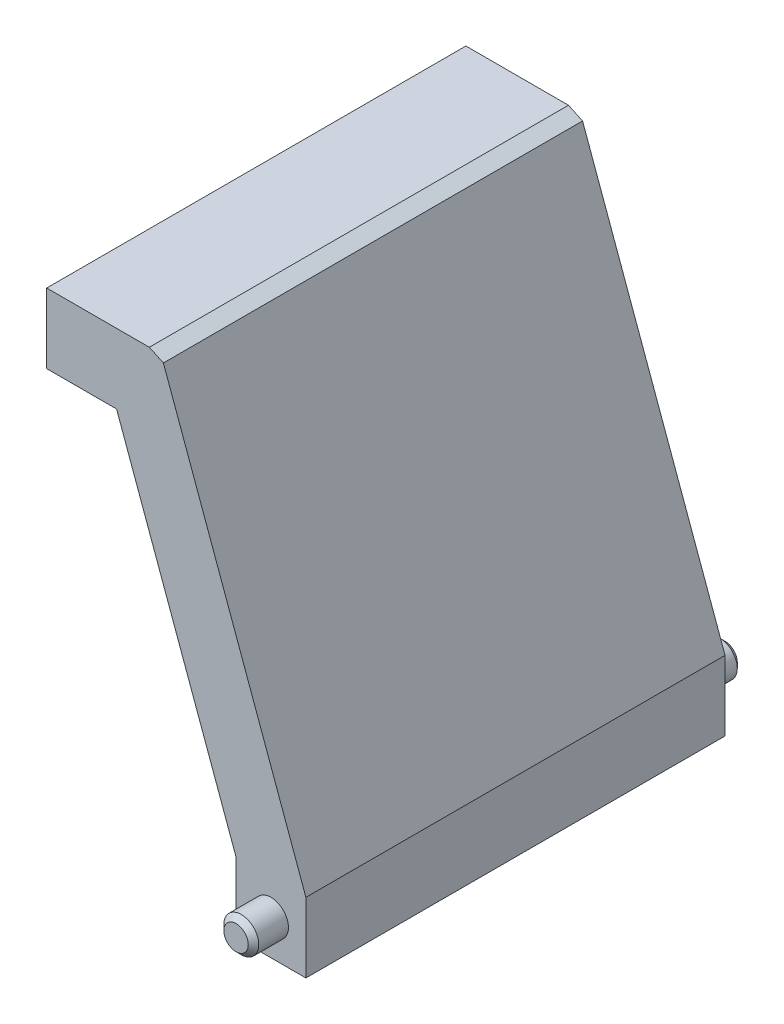
from build123d import *

# Parameters (mm, degrees)
SKETCH1_W           = 10.000000000000004
SKETCH1_H           = 10
SKETCH1_W_2         = 10
BOSS_EXTRUDE1_DEPTH = 60
CHAMFER1_SIZE       = 3
SKETCH2_R           = 2.5
BOSS_EXTRUDE2_DEPTH = 5
BOSS_EXTRUDE3_START = -65
SKETCH2_2_R         = 2.5
BOSS_EXTRUDE3_DEPTH = 5
CHAMFER2_SIZE       = 1
CHAMFER2_SIZE2      = 1.6731571851015
CHAMFER3_SIZE       = 0.75


with BuildPart() as part:
    # Sketch1 → Boss-Extrude1 (new body)
    with BuildSketch(Plane.XY):
        with Locations((-27.101007166283644, 56.98463103929536)):
            Rectangle(SKETCH1_W, SKETCH1_H)
        Polygon((-12.10100716628364, 51.98463103929536), (-15.740709508945711, 61.98463103929536), (-22.10100716628364, 61.98463103929536), (-22.10100716628364, 51.98463103929536), (-5, 5), (5, 5), align=None)
        Rectangle(SKETCH1_W_2, SKETCH1_H)
    extrude(amount=BOSS_EXTRUDE1_DEPTH)

    # Chamfer1
    chamfer1_edges = [part.edges().sort_by_distance(p)[0] for p in [
        (-5, -5, 30),
    ]]
    chamfer(chamfer1_edges, length=CHAMFER1_SIZE)

    # Sketch2 → Boss-Extrude2 (add)
    with BuildSketch(Plane.XY.offset(60)):
        Circle(SKETCH2_R)
    extrude(amount=BOSS_EXTRUDE2_DEPTH)

    # Sketch2<2> → Boss-Extrude3 (add)
    with BuildSketch(Plane.XY.offset(60).offset(BOSS_EXTRUDE3_START)):
        Circle(SKETCH2_2_R)
    extrude(amount=BOSS_EXTRUDE3_DEPTH)

    # Chamfer2
    chamfer2_edges = [part.edges().sort_by_distance(p)[0] for p in [
        (-15.740709508945711, 61.98463103929536, 30),
    ]]
    chamfer2_side = [part.faces().sort_by_distance(p)[0] for p in [
        (-5.3703547544728565, 33.492315519647676, 30),
    ]]
    chamfer(chamfer2_edges, length=CHAMFER2_SIZE, length2=CHAMFER2_SIZE2, reference=chamfer2_side[0])

    # Chamfer3
    chamfer3_edges = [part.edges().sort_by_distance(p)[0] for p in [
        (-2.5, 3.1e-16, 65),
        (-2.5, 3.1e-16, -5),
    ]]
    chamfer(chamfer3_edges, length=CHAMFER3_SIZE)


solid = part.part
